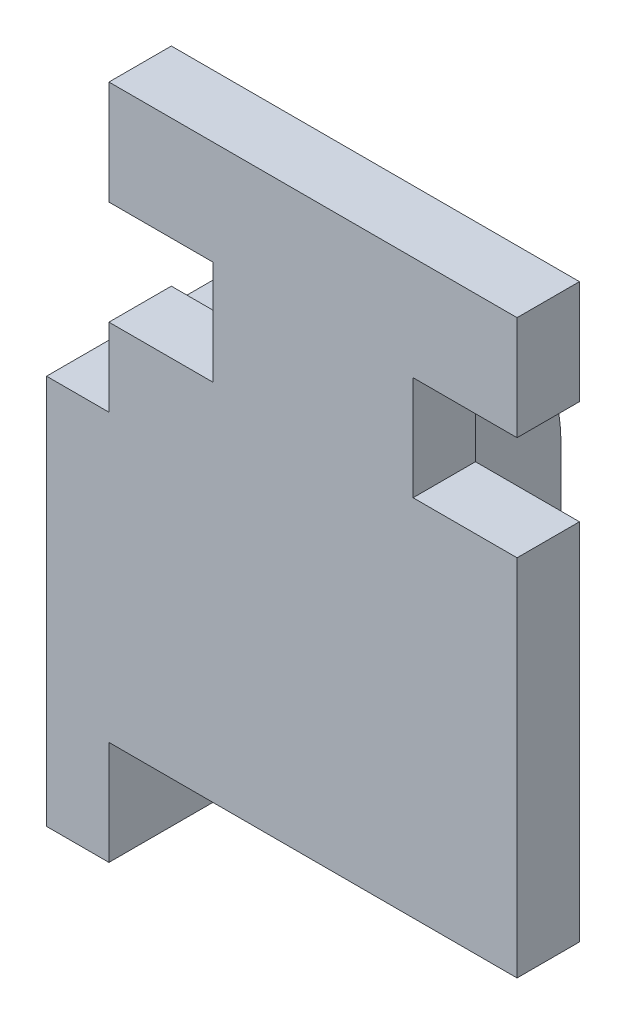
from build123d import *

# Parameters (mm, degrees)
BOSS_EXTRUDE1_DEPTH = 0.24
BOSS_EXTRUDE2_DEPTH = 0.24
FILLET1_R           = 1


with BuildPart() as part:
    # Sketch1 → Boss-Extrude1 (new body)
    with BuildSketch(Plane.XY):
        Polygon((0, 0), (0, 1.4), (0.4, 1.4), (0.4, 1.8), (0, 1.8), (0, 2.2), (1.57, 2.2), (1.57, 1.8), (1.17, 1.8), (1.17, 1.4), (1.57, 1.4), (1.57, 0), align=None)
    extrude(amount=BOSS_EXTRUDE1_DEPTH)

    # Sketch2 → Boss-Extrude2 (add)
    with BuildSketch(Plane.ZY):
        Polygon((0.24, 0), (0.24, -0.4), (-1.5, -0.4), (-1.5, 1.1), (0, 1.1), (0.24, 1.1), align=None)
    extrude(amount=BOSS_EXTRUDE2_DEPTH)

    # Fillet1
    fillet1_edges = [part.edges().sort_by_distance(p)[0] for p in [
        (-0.12, 1.1, -1.5),
    ]]
    fillet(fillet1_edges, radius=FILLET1_R)


solid = part.part
